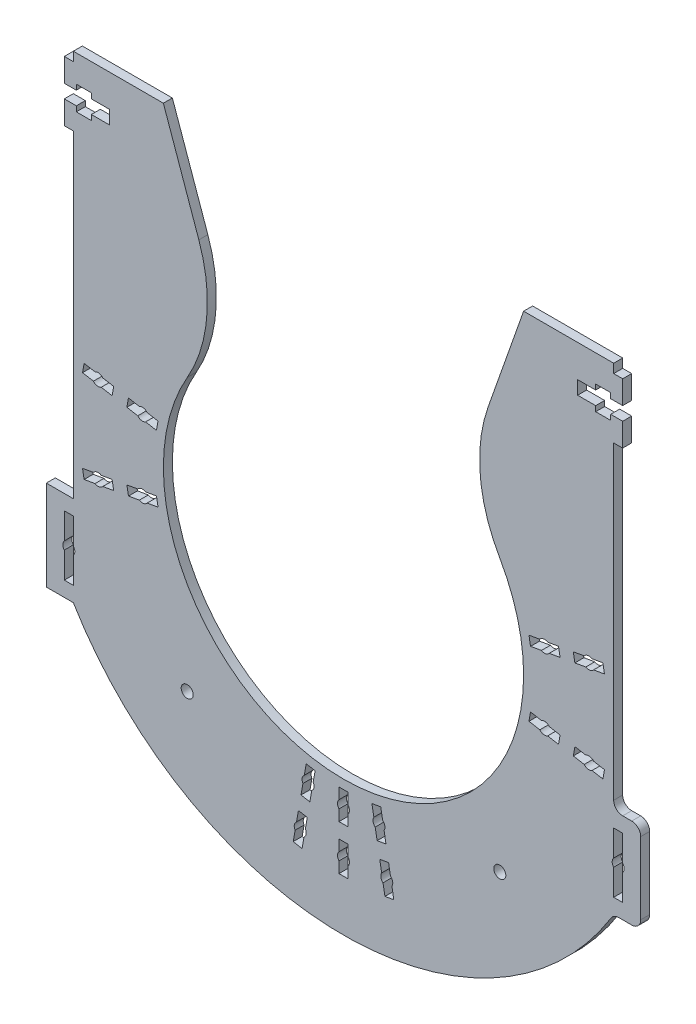
from build123d import *

# Parameters (mm, degrees)
SKETCH_1_R          = 2
EXTRUDE_1_DEPTH     = 1.5
CUT_EXTRUDE_1_DEPTH = 141.296115413
FILLET_1_R          = 50
EXTRUDE_2_DEPTH     = 3
FILLET_2_R          = 3
SKETCH_6_W          = 5
SKETCH_6_H          = 1.75
SKETCH_6_H_2        = 4.5
SKETCH_6_W_2        = 6
SKETCH_6_W_3        = 4
CUT_EXTRUDE_2_DEPTH = 145.343340685
SKETCH_8_R          = 2
CUT_EXTRUDE_4_DEPTH = 10


with BuildPart() as part:
    # 草图1 → 凸台-拉伸1 (new, symmetric)
    with BuildSketch(Plane.XY):
        with BuildLine():
            Line((-39.047482407, 45.555396142), (-60, 105))
            Line((-60, 105), (-90, 105))
            Line((-90, 105), (-90, 102))
            Line((-90, 102), (-93, 102))
            Line((-93, 102), (-93, 82))
            Line((-93, 82), (-90, 82))
            Line((-90, 82), (-90, -54.083269132))
            ThreePointArc((-90, -54.083269132), (0, -105), (90, -54.083269132))
            Line((90, -54.083269132), (90, 82))
            Line((90, 82), (93, 82))
            Line((93, 82), (93, 102))
            Line((93, 102), (90, 102))
            Line((90, 102), (90, 105))
            Line((90, 105), (60, 105))
            Line((60, 105), (39.047482407, 45.555396142))
            ThreePointArc((39.047482407, 45.555396142), (0, -60), (-39.047482407, 45.555396142))
        make_face()
        with Locations((-52.063309876, -60.740528189)):
            Circle(SKETCH_1_R, mode=Mode.SUBTRACT)
        with Locations((52.063309876, -60.740528189)):
            Circle(SKETCH_1_R, mode=Mode.SUBTRACT)
    extrude(amount=EXTRUDE_1_DEPTH, both=True)

    # 草图2 → 切除-拉伸1 (cut, through all)
    with BuildSketch(Plane.XY.offset(1.5)):
        with BuildLine():
            ThreePointArc((-80.175793032, -15.660295429), (-81.391747145, -16.382414252), (-82.781349435, -16.119725323))
            Line((-82.781349435, -16.119725323), (-86.402609999, -16.758251264))
            Line((-86.402609999, -16.758251264), (-86.923554532, -13.803828005))
            Line((-86.923554532, -13.803828005), (-83.302293968, -13.165302064))
            ThreePointArc((-83.302293968, -13.165302064), (-82.086339855, -12.44318324), (-80.696737565, -12.70587217))
            Line((-80.696737565, -12.70587217), (-77.075477001, -12.067346229))
            Line((-77.075477001, -12.067346229), (-76.554532468, -15.021769488))
            Line((-76.554532468, -15.021769488), (-80.175793032, -15.660295429))
        make_face()
        with BuildLine():
            ThreePointArc((-65.403676736, -13.055572764), (-66.619630849, -13.777691587), (-68.00923314, -13.515002658))
            Line((-68.00923314, -13.515002658), (-71.630493703, -14.153528599))
            Line((-71.630493703, -14.153528599), (-72.151438236, -11.19910534))
            Line((-72.151438236, -11.19910534), (-68.530177673, -10.560579399))
            ThreePointArc((-68.530177673, -10.560579399), (-67.31422356, -9.838460575), (-65.924621269, -10.101149505))
            Line((-65.924621269, -10.101149505), (-62.303360706, -9.462623563))
            Line((-62.303360706, -9.462623563), (-61.782416173, -12.417046823))
            Line((-61.782416173, -12.417046823), (-65.403676736, -13.055572764))
        make_face()
        with BuildLine():
            Line((-68.530177673, 10.560579399), (-72.151438236, 11.19910534))
            Line((-72.151438236, 11.19910534), (-71.630493703, 14.153528599))
            Line((-71.630493703, 14.153528599), (-68.00923314, 13.515002658))
            ThreePointArc((-68.00923314, 13.515002658), (-66.619630849, 13.777691587), (-65.403676736, 13.055572764))
            Line((-65.403676736, 13.055572764), (-61.782416173, 12.417046823))
            Line((-61.782416173, 12.417046823), (-62.303360706, 9.462623563))
            Line((-62.303360706, 9.462623563), (-65.924621269, 10.101149505))
            ThreePointArc((-65.924621269, 10.101149505), (-67.31422356, 9.838460575), (-68.530177673, 10.560579399))
        make_face()
        with BuildLine():
            Line((-83.302293968, 13.165302064), (-86.923554532, 13.803828005))
            Line((-86.923554532, 13.803828005), (-86.402609999, 16.758251264))
            Line((-86.402609999, 16.758251264), (-82.781349435, 16.119725323))
            ThreePointArc((-82.781349435, 16.119725323), (-81.391747145, 16.382414252), (-80.175793032, 15.660295429))
            Line((-80.175793032, 15.660295429), (-76.554532468, 15.021769488))
            Line((-76.554532468, 15.021769488), (-77.075477001, 12.067346229))
            Line((-77.075477001, 12.067346229), (-80.696737565, 12.70587217))
            ThreePointArc((-80.696737565, 12.70587217), (-82.086339855, 12.44318324), (-83.302293968, 13.165302064))
        make_face()
        with BuildLine():
            Line((83.302293968, -13.165302064), (86.923554532, -13.803828005))
            Line((86.923554532, -13.803828005), (86.402609999, -16.758251264))
            Line((86.402609999, -16.758251264), (82.781349435, -16.119725323))
            ThreePointArc((82.781349435, -16.119725323), (81.391747145, -16.382414252), (80.175793032, -15.660295429))
            Line((80.175793032, -15.660295429), (76.554532468, -15.021769488))
            Line((76.554532468, -15.021769488), (77.075477001, -12.067346229))
            Line((77.075477001, -12.067346229), (80.696737565, -12.70587217))
            ThreePointArc((80.696737565, -12.70587217), (82.086339855, -12.44318324), (83.302293968, -13.165302064))
        make_face()
        with BuildLine():
            Line((68.530177673, -10.560579399), (72.151438236, -11.19910534))
            Line((72.151438236, -11.19910534), (71.630493703, -14.153528599))
            Line((71.630493703, -14.153528599), (68.00923314, -13.515002658))
            ThreePointArc((68.00923314, -13.515002658), (66.619630849, -13.777691587), (65.403676736, -13.055572764))
            Line((65.403676736, -13.055572764), (61.782416173, -12.417046823))
            Line((61.782416173, -12.417046823), (62.303360706, -9.462623563))
            Line((62.303360706, -9.462623563), (65.924621269, -10.101149505))
            ThreePointArc((65.924621269, -10.101149505), (67.31422356, -9.838460575), (68.530177673, -10.560579399))
        make_face()
        with BuildLine():
            ThreePointArc((65.403676736, 13.055572764), (66.619630849, 13.777691587), (68.00923314, 13.515002658))
            Line((68.00923314, 13.515002658), (71.630493703, 14.153528599))
            Line((71.630493703, 14.153528599), (72.151438236, 11.19910534))
            Line((72.151438236, 11.19910534), (68.530177673, 10.560579399))
            ThreePointArc((68.530177673, 10.560579399), (67.31422356, 9.838460575), (65.924621269, 10.101149505))
            Line((65.924621269, 10.101149505), (62.303360706, 9.462623563))
            Line((62.303360706, 9.462623563), (61.782416173, 12.417046823))
            Line((61.782416173, 12.417046823), (65.403676736, 13.055572764))
        make_face()
        with BuildLine():
            ThreePointArc((15.660295429, -80.175793032), (16.382414252, -81.391747145), (16.119725323, -82.781349435))
            Line((16.119725323, -82.781349435), (16.758251264, -86.402609999))
            Line((16.758251264, -86.402609999), (13.803828005, -86.923554532))
            Line((13.803828005, -86.923554532), (13.165302064, -83.302293968))
            ThreePointArc((13.165302064, -83.302293968), (12.44318324, -82.086339855), (12.70587217, -80.696737565))
            Line((12.70587217, -80.696737565), (12.067346229, -77.075477001))
            Line((12.067346229, -77.075477001), (15.021769488, -76.554532468))
            Line((15.021769488, -76.554532468), (15.660295429, -80.175793032))
        make_face()
        with BuildLine():
            ThreePointArc((13.055572764, -65.403676736), (13.777691587, -66.619630849), (13.515002658, -68.00923314))
            Line((13.515002658, -68.00923314), (14.153528599, -71.630493703))
            Line((14.153528599, -71.630493703), (11.19910534, -72.151438236))
            Line((11.19910534, -72.151438236), (10.560579399, -68.530177673))
            ThreePointArc((10.560579399, -68.530177673), (9.838460575, -67.31422356), (10.101149505, -65.924621269))
            Line((10.101149505, -65.924621269), (9.462623563, -62.303360706))
            Line((9.462623563, -62.303360706), (12.417046823, -61.782416173))
            Line((12.417046823, -61.782416173), (13.055572764, -65.403676736))
        make_face()
        with BuildLine():
            Line((-1.5, -78), (-1.5, -81.677124344))
            ThreePointArc((-1.5, -81.677124344), (-2, -83), (-1.5, -84.322875656))
            Line((-1.5, -84.322875656), (-1.5, -88))
            Line((-1.5, -88), (1.5, -88))
            Line((1.5, -88), (1.5, -84.322875656))
            ThreePointArc((1.5, -84.322875656), (2, -83), (1.5, -81.677124344))
            Line((1.5, -81.677124344), (1.5, -78))
            Line((1.5, -78), (-1.5, -78))
        make_face()
        with BuildLine():
            Line((1.5, -69.322875656), (1.5, -73))
            Line((1.5, -73), (-1.5, -73))
            Line((-1.5, -73), (-1.5, -69.322875656))
            ThreePointArc((-1.5, -69.322875656), (-2, -68), (-1.5, -66.677124344))
            Line((-1.5, -66.677124344), (-1.5, -63))
            Line((-1.5, -63), (1.5, -63))
            Line((1.5, -63), (1.5, -66.677124344))
            ThreePointArc((1.5, -66.677124344), (2, -68), (1.5, -69.322875656))
        make_face()
        with BuildLine():
            Line((-10.560579399, -68.530177673), (-11.19910534, -72.151438236))
            Line((-11.19910534, -72.151438236), (-14.153528599, -71.630493703))
            Line((-14.153528599, -71.630493703), (-13.515002658, -68.00923314))
            ThreePointArc((-13.515002658, -68.00923314), (-13.777691587, -66.619630849), (-13.055572764, -65.403676736))
            Line((-13.055572764, -65.403676736), (-12.417046823, -61.782416173))
            Line((-12.417046823, -61.782416173), (-9.462623563, -62.303360706))
            Line((-9.462623563, -62.303360706), (-10.101149505, -65.924621269))
            ThreePointArc((-10.101149505, -65.924621269), (-9.838460575, -67.31422356), (-10.560579399, -68.530177673))
        make_face()
        with BuildLine():
            Line((-13.165302064, -83.302293968), (-13.803828005, -86.923554532))
            Line((-13.803828005, -86.923554532), (-16.758251264, -86.402609999))
            Line((-16.758251264, -86.402609999), (-16.119725323, -82.781349435))
            ThreePointArc((-16.119725323, -82.781349435), (-16.382414252, -81.391747145), (-15.660295429, -80.175793032))
            Line((-15.660295429, -80.175793032), (-15.021769488, -76.554532468))
            Line((-15.021769488, -76.554532468), (-12.067346229, -77.075477001))
            Line((-12.067346229, -77.075477001), (-12.70587217, -80.696737565))
            ThreePointArc((-12.70587217, -80.696737565), (-12.44318324, -82.086339855), (-13.165302064, -83.302293968))
        make_face()
        with BuildLine():
            Line((76.554532468, 15.021769488), (80.175793032, 15.660295429))
            ThreePointArc((80.175793032, 15.660295429), (81.391747145, 16.382414252), (82.781349435, 16.119725323))
            Line((82.781349435, 16.119725323), (86.402609999, 16.758251264))
            Line((86.402609999, 16.758251264), (86.923554532, 13.803828005))
            Line((86.923554532, 13.803828005), (83.302293968, 13.165302064))
            ThreePointArc((83.302293968, 13.165302064), (82.086339855, 12.44318324), (80.696737565, 12.70587217))
            Line((80.696737565, 12.70587217), (77.075477001, 12.067346229))
            Line((77.075477001, 12.067346229), (76.554532468, 15.021769488))
        make_face()
    extrude(amount=-CUT_EXTRUDE_1_DEPTH, mode=Mode.SUBTRACT)

    # 圆角1
    fillet_1_edges = [part.edges().sort_by_distance(p)[0] for p in [
        (-39.047482407, 45.555396142, 0),
        (39.047482407, 45.555396142, 0),
    ]]
    fillet(fillet_1_edges, radius=FILLET_1_R)

    # 草图3 → 凸台-拉伸2 (add)
    with BuildSketch(Plane.XY.offset(1.5)):
        with BuildLine():
            Line((90, -49.083269132), (90, -54.083269132))
            Line((90, -54.083269132), (99, -54.083269132))
            Line((99, -54.083269132), (99, -24.083269132))
            Line((99, -24.083269132), (90, -24.083269132))
            Line((90, -24.083269132), (90, -29.083269132))
            Line((90, -29.083269132), (93, -29.083269132))
            Line((93, -29.083269132), (93, -37.760393476))
            ThreePointArc((93, -37.760393476), (93.370828693, -38.376162351), (93.5, -39.083269132))
            ThreePointArc((93.5, -39.083269132), (93.370828693, -39.790375913), (93, -40.406144787))
            Line((93, -40.406144787), (93, -49.083269132))
            Line((93, -49.083269132), (90, -49.083269132))
        make_face()
    extrude_2 = extrude(amount=-EXTRUDE_2_DEPTH)

    # 圆角2
    fillet_2_edges = [part.edges().sort_by_distance(p)[0] for p in [
        (90, -54.083269132, 0),
        (90, -24.083269132, 0),
        (99, -24.083269132, 0),
        (99, -54.083269132, 0),
    ]]
    fillet(fillet_2_edges, radius=FILLET_2_R)

    # 镜向1: 凸台-拉伸2 across plane
    add(extrude_2.mirror(Plane(origin=(0, 0, 0), x_dir=(0, 0, 1), z_dir=(1, 0, 0))))

    # 草图6 → 切除-拉伸2 (cut, through all)
    with BuildSketch(Plane(origin=(0, 0, -1.5), x_dir=(-1, 0, 0), z_dir=(0, 0, -1))):
        with Locations((-86.5, 88.875)):
            Rectangle(SKETCH_6_W, SKETCH_6_H)
        with Locations((-86.5, 92)):
            Rectangle(SKETCH_6_W, SKETCH_6_H_2)
        with Locations((-86.5, 95.125)):
            Rectangle(SKETCH_6_W, SKETCH_6_H)
        with Locations((-81, 92)):
            Rectangle(SKETCH_6_W_2, SKETCH_6_H_2)
        with Locations((-91, 92)):
            Rectangle(SKETCH_6_W_3, SKETCH_6_H_2)
        with Locations((91, 92)):
            Rectangle(SKETCH_6_W_3, SKETCH_6_H_2)
        with Locations((86.5, 92)):
            Rectangle(SKETCH_6_W, SKETCH_6_H_2)
        with Locations((86.5, 95.125)):
            Rectangle(SKETCH_6_W, SKETCH_6_H)
        with Locations((86.5, 88.875)):
            Rectangle(SKETCH_6_W, SKETCH_6_H)
        with Locations((81, 92)):
            Rectangle(SKETCH_6_W_2, SKETCH_6_H_2)
    extrude(amount=-CUT_EXTRUDE_2_DEPTH, mode=Mode.SUBTRACT)

    # 草图8 → 切除-拉伸4 (cut)
    with BuildSketch(Plane.XY.offset(1.5)):
        with Locations((-91.5, -39.083269132)):
            Circle(SKETCH_8_R)
        with Locations((91.5, -39.083269132)):
            Circle(SKETCH_8_R)
    extrude(amount=-CUT_EXTRUDE_4_DEPTH, mode=Mode.SUBTRACT)


solid = part.part
